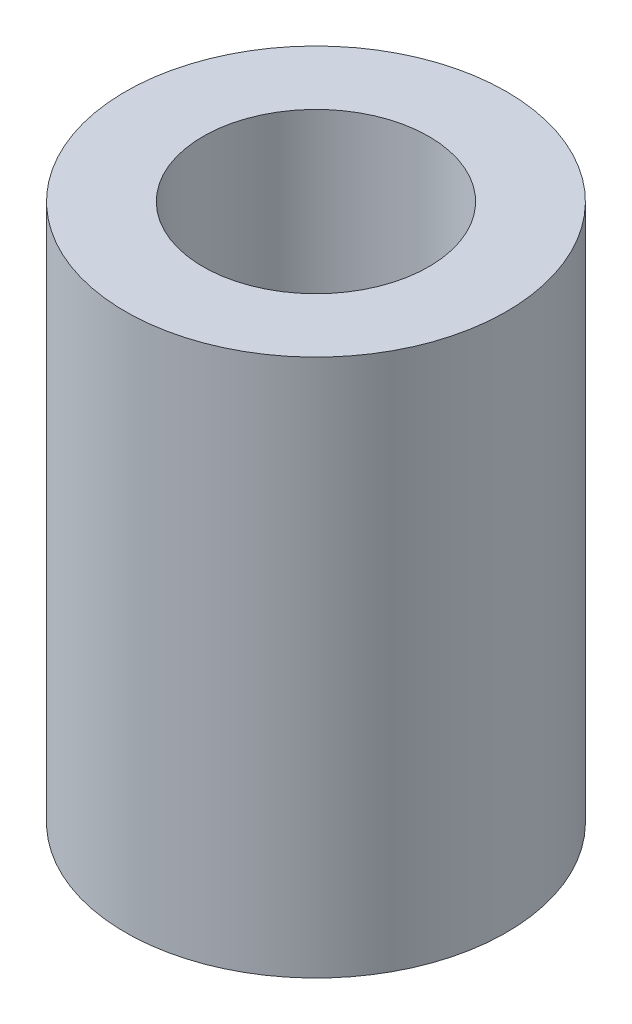
from build123d import *

# Parameters (mm, degrees)
SKETCH1_R           = 2.7
SKETCH1_R_2         = 1.6
BOSS_EXTRUDE1_DEPTH = 7.62


with BuildPart() as part:
    # Sketch1 → Boss-Extrude1 (new body)
    with BuildSketch(Plane(origin=(0, 0, 0), x_dir=(1, 0, 0), z_dir=(0, 1, 0))):
        with Locations(Location((0, 0, 0), (0, 0, 90))):
            Circle(SKETCH1_R)
        with Locations(Location((0, 0, 0), (0, 0, 90))):
            Circle(SKETCH1_R_2, mode=Mode.SUBTRACT)
    extrude(amount=BOSS_EXTRUDE1_DEPTH)


solid = part.part
